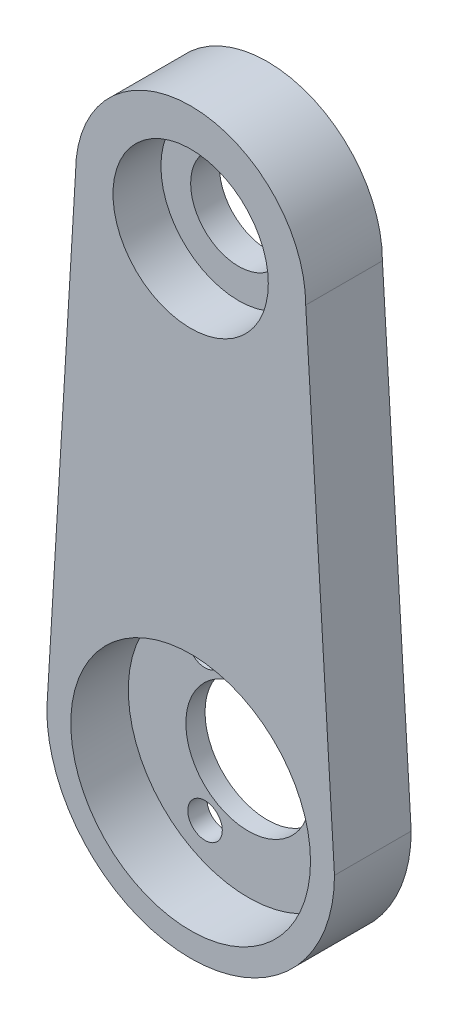
from build123d import *

# Parameters (mm, degrees)
BOSS_EXTRU_1_DEPTH      = 8
ESQUISSE2_R             = 6.5
ENL_V_MAT_EXTRU_1_DEPTH = 10
ESQUISSE3_R             = 1.8
ENL_V_MAT_EXTRU_2_DEPTH = 10
ESQUISSE5_R             = 12.5
ENL_V_MAT_EXTRU_5_DEPTH = 6
ESQUISSE19_R            = 8.1
ENL_V_MAT_EXTRU_6_DEPTH = 10
BOSS_EXTRU_2_START      = -3
ESQUISSE22_R            = 8.1
ESQUISSE22_R_2          = 5
BOSS_EXTRU_2_DEPTH      = 3


with BuildPart() as part:
    # Esquisse1 → Boss.-Extru.1 (new body)
    with BuildSketch(Plane.XY):
        with BuildLine():
            Line((12, 0), (15, -50))
            ThreePointArc((15, -50), (0, -65), (-15, -50))
            Line((-15, -50), (-12, 0))
            ThreePointArc((-12, 0), (0, 12), (12, 0))
        make_face()
    extrude(amount=BOSS_EXTRU_1_DEPTH)

    # Esquisse2 → Enlèv. mat.-Extru.1 (cut)
    with BuildSketch(Plane.XY.offset(8)):
        with Locations((0, -50)):
            Circle(ESQUISSE2_R)
    extrude(amount=-ENL_V_MAT_EXTRU_1_DEPTH, mode=Mode.SUBTRACT)

    # Esquisse3 → Enlèv. mat.-Extru.2 (cut)
    with BuildSketch(Plane.XY.offset(8)):
        with Locations((-4.5, -57.794228634)):
            Circle(ESQUISSE3_R)
        with Locations((-4.5, -42.205771366)):
            Circle(ESQUISSE3_R)
        with Locations((9, -50)):
            Circle(ESQUISSE3_R)
    extrude(amount=-ENL_V_MAT_EXTRU_2_DEPTH, mode=Mode.SUBTRACT)

    # Esquisse5 → Enlèv. mat.-Extru.5 (cut)
    with BuildSketch(Plane.XY.offset(8)):
        with Locations((0, -50)):
            Circle(ESQUISSE5_R)
    extrude(amount=-ENL_V_MAT_EXTRU_5_DEPTH, mode=Mode.SUBTRACT)

    # Esquisse19 → Enlèv. mat.-Extru.6 (cut)
    with BuildSketch(Plane.XY.offset(8)):
        Circle(ESQUISSE19_R)
    extrude(amount=-ENL_V_MAT_EXTRU_6_DEPTH, mode=Mode.SUBTRACT)

    # Esquisse22 → Boss.-Extru.2 (add)
    with BuildSketch(Plane(origin=(0, 0, 0), x_dir=(-1, 0, 0), z_dir=(0, 0, -1)).offset(BOSS_EXTRU_2_START)):
        with Locations(Location((0, 0, 0), (0, 0, 180))):
            Circle(ESQUISSE22_R)
        Circle(ESQUISSE22_R_2, mode=Mode.SUBTRACT)
    extrude(amount=BOSS_EXTRU_2_DEPTH)


solid = part.part
